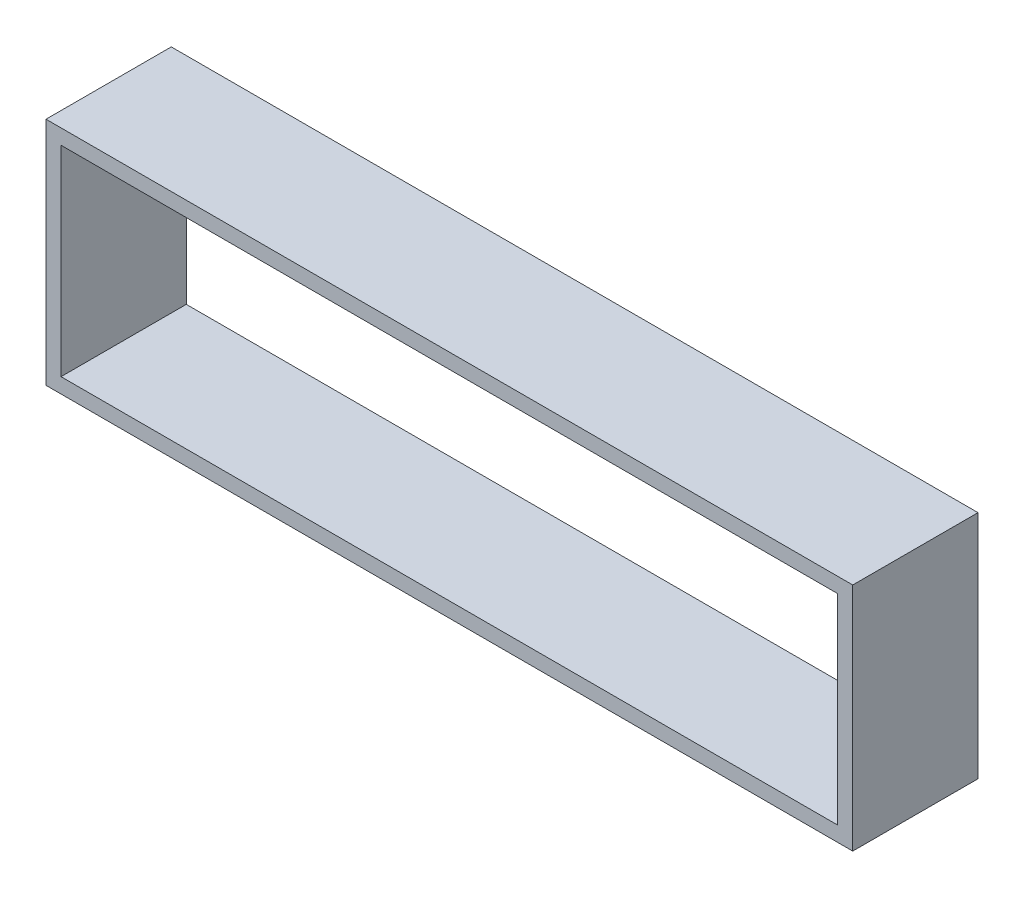
from build123d import *

# Parameters (mm, degrees)
SKETCH_1_W      = 161
SKETCH_1_H      = 46
SKETCH_1_W_2    = 155
SKETCH_1_H_2    = 40
EXTRUDE_1_DEPTH = 25


with BuildPart() as part:
    # Эскиз1 → Бобышка-Вытянуть1 (new body)
    with BuildSketch(Plane.XY):
        with Locations((77.5, 20)):
            Rectangle(SKETCH_1_W, SKETCH_1_H)
        with Locations((77.5, 20)):
            Rectangle(SKETCH_1_W_2, SKETCH_1_H_2, mode=Mode.SUBTRACT)
    extrude(amount=EXTRUDE_1_DEPTH)


solid = part.part
